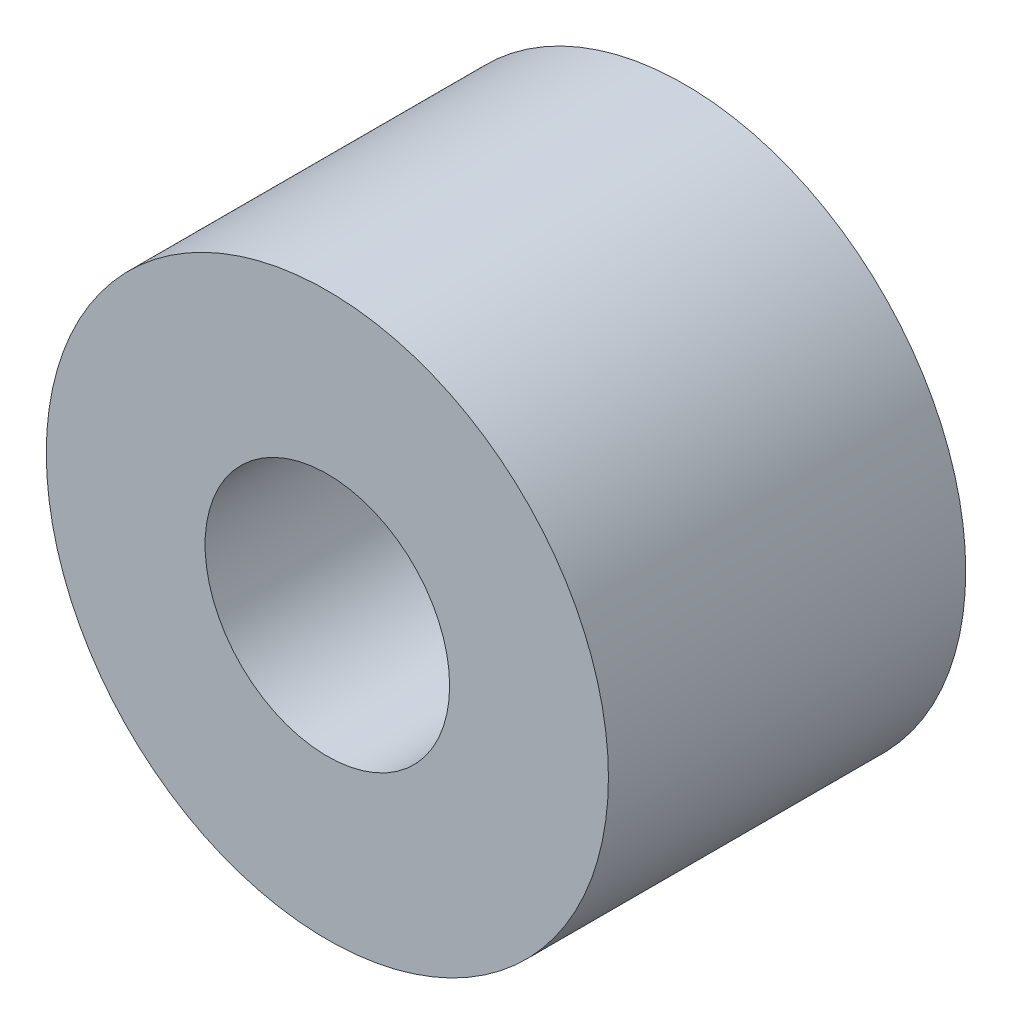
from build123d import *

# Parameters (mm, degrees)
SKETCH1_R           = 11.2395
SKETCH1_R_2         = 4.8895
BOSS_EXTRUDE1_DEPTH = 14.2875


with BuildPart() as part:
    # Sketch1 → Boss-Extrude1 (new body)
    with BuildSketch(Plane.XY):
        Circle(SKETCH1_R)
        Circle(SKETCH1_R_2, mode=Mode.SUBTRACT)
    extrude(amount=BOSS_EXTRUDE1_DEPTH)


solid = part.part
